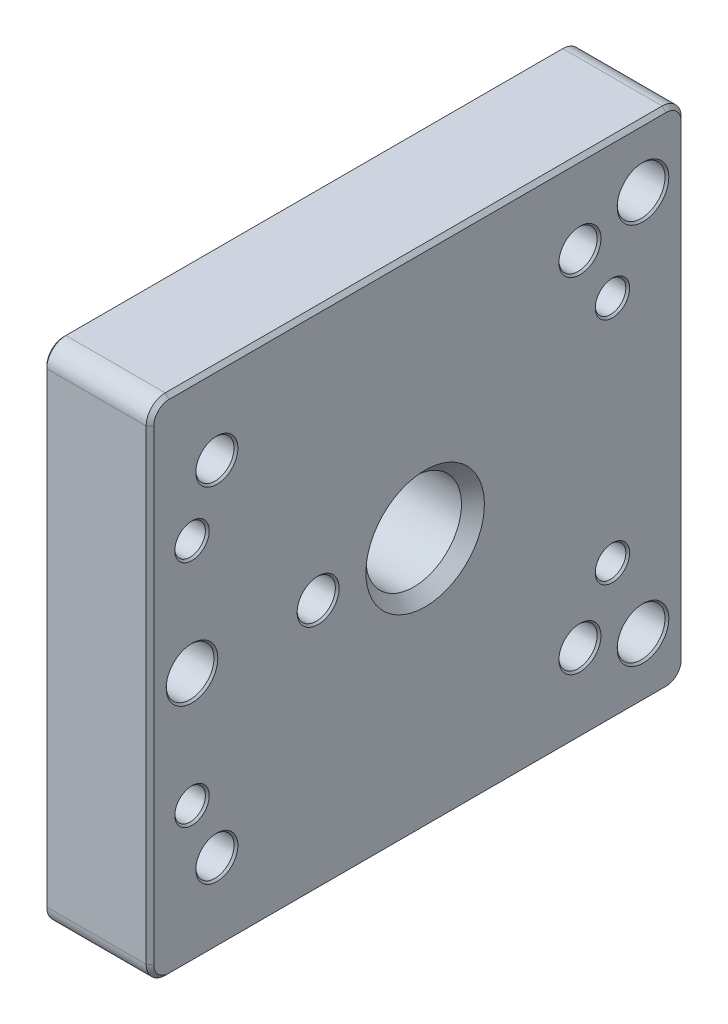
from build123d import *

# Parameters (mm, degrees)
SKETCH_1_W                    = 26.4
SKETCH_1_H                    = 28
EXTRUDE_1_DEPTH               = 5.5
HOLE_WIZARD_1_6_1_6_1_D       = 1.6
HOLE_WIZARD_2_5_2_5_1_D       = 2.5
HOLE_WIZARD_1_6_1_6_2_D       = 1.6
HOLE_WIZARD_2_5_2_5_2_D       = 2.5
HOLE_WIZARD_5_0_5_1_D         = 5
HOLE_WIZARD_M1_61_D           = 2
HOLE_WIZARD_M1_61_CBORE_D     = 3.2
HOLE_WIZARD_M1_61_CBORE_DEPTH = 3.5
FILLET_1_R                    = 1
CHAMFER_1_SIZE2               = 0.6
CHAMFER_1_SIZE                = 0.599999999
CHAMFER_2_SIZE                = 0.1
CHAMFER_3_SIZE                = 0.2


with BuildPart() as part:
    # Эскиз1 → Бобышка-Вытянуть1 (new body)
    with BuildSketch(Plane(origin=(0, 0, 0), x_dir=(0, -1, 0), z_dir=(-1, 0, 0))):
        Rectangle(SKETCH_1_W, SKETCH_1_H)
    extrude(amount=-EXTRUDE_1_DEPTH)

    # Диаметр отверстия Ø1.6 (1.6)1 (through all)
    with Locations(Plane.ZY):
        with Locations((-10.2, -6), (11.8, -6), (11.8, 6)):
            Hole(HOLE_WIZARD_1_6_1_6_1_D / 2)

    # Диаметр отверстия Ø2.5 (2.5)1 (through all)
    with Locations(Plane(origin=(5.5, 0, 0), x_dir=(0, 0, -1), z_dir=(1, 0, 0))):
        with Locations((11.8, -10)):
            Hole(HOLE_WIZARD_2_5_2_5_1_D / 2)

    # Диаметр отверстия Ø1.6 (1.6)2 (through all)
    with Locations(Plane(origin=(5.5, 0, 0), x_dir=(0, 0, -1), z_dir=(1, 0, 0))):
        with Locations((10.2, 6)):
            Hole(HOLE_WIZARD_1_6_1_6_2_D / 2)

    # Диаметр отверстия Ø2.5 (2.5)2 (through all)
    with Locations(Plane.ZY):
        with Locations((-11.8, 10), (11.8, 0)):
            Hole(HOLE_WIZARD_2_5_2_5_2_D / 2)

    # Диаметр отверстия Ø5.0 (5)1 (through all)
    with Locations(Plane(origin=(5.5, 0, 0), x_dir=(0, 0, -1), z_dir=(1, 0, 0))):
        with Locations((0.4, 0)):
            Hole(HOLE_WIZARD_5_0_5_1_D / 2)

    # Цековка для винта с внутренним шестигранником M1.61 (through all)
    with Locations(Plane.ZY):
        with Locations((-8.5, 9), (-8.5, -9), (5.2, 0), (10.5, -9), (10.5, 9)):
            CounterBoreHole(HOLE_WIZARD_M1_61_D / 2, HOLE_WIZARD_M1_61_CBORE_D / 2, HOLE_WIZARD_M1_61_CBORE_DEPTH)

    # Скругление1
    fillet_1_edges = [part.edges().sort_by_distance(p)[0] for p in [
        (2.75, -13.2, 14),
        (2.75, -13.2, -14),
        (2.75, 13.2, -14),
        (2.75, 13.2, 14),
    ]]
    fillet(fillet_1_edges, radius=FILLET_1_R)

    # Фаска1
    chamfer_1_edges = [part.edges().sort_by_distance(p)[0] for p in [
        (5.5, 0, -2.9),
        (0, 0, -2.9),
    ]]
    chamfer(chamfer_1_edges, length=CHAMFER_1_SIZE, length2=CHAMFER_1_SIZE2)

    # Фаска2
    chamfer_2_edges = [part.edges().sort_by_distance(p)[0] for p in [
        (0, 6, 12.6),
        (5.5, 6, 12.6),
        (0, -6, 12.6),
        (5.5, -6, 12.6),
        (0, -6, -9.4),
        (5.5, -6, -9.4),
        (5.5, -10, -13.05),
        (0, -10, -13.05),
        (5.5, 6, -11),
        (0, 6, -11),
        (0, 0, 13.05),
        (5.5, 0, 13.05),
        (0, 10, -10.55),
        (5.5, 10, -10.55),
        (0, 9, 8.9),
        (5.5, 9, 11.5),
        (3.5, 9, 11.5),
        (0, -9, 8.9),
        (5.5, -9, 11.5),
        (3.5, -9, 11.5),
        (0, 0, 3.6),
        (5.5, 0, 6.2),
        (3.5, 0, 6.2),
        (0, -9, -10.1),
        (5.5, -9, -7.5),
        (3.5, -9, -7.5),
        (0, 9, -10.1),
        (5.5, 9, -7.5),
        (3.5, 9, -7.5),
        (0, 0, 14),
        (0, 13.2, 0),
        (0, 0, -14),
        (0, -13.2, 0),
        (0, -12.907106781, 13.707106781),
        (0, -12.907106781, -13.707106781),
        (0, 12.907106781, -13.707106781),
        (0, 12.907106781, 13.707106781),
    ]]
    chamfer(chamfer_2_edges, length=CHAMFER_2_SIZE)

    # Фаска3
    chamfer_3_edges = [part.edges().sort_by_distance(p)[0] for p in [
        (5.5, 0, 14),
        (5.5, 13.2, 0),
        (5.5, -13.2, 0),
        (5.5, 0, -14),
        (5.5, -12.907106781, 13.707106781),
        (5.5, -12.907106781, -13.707106781),
        (5.5, 12.907106781, -13.707106781),
        (5.5, 12.907106781, 13.707106781),
    ]]
    chamfer(chamfer_3_edges, length=CHAMFER_3_SIZE)


solid = part.part
